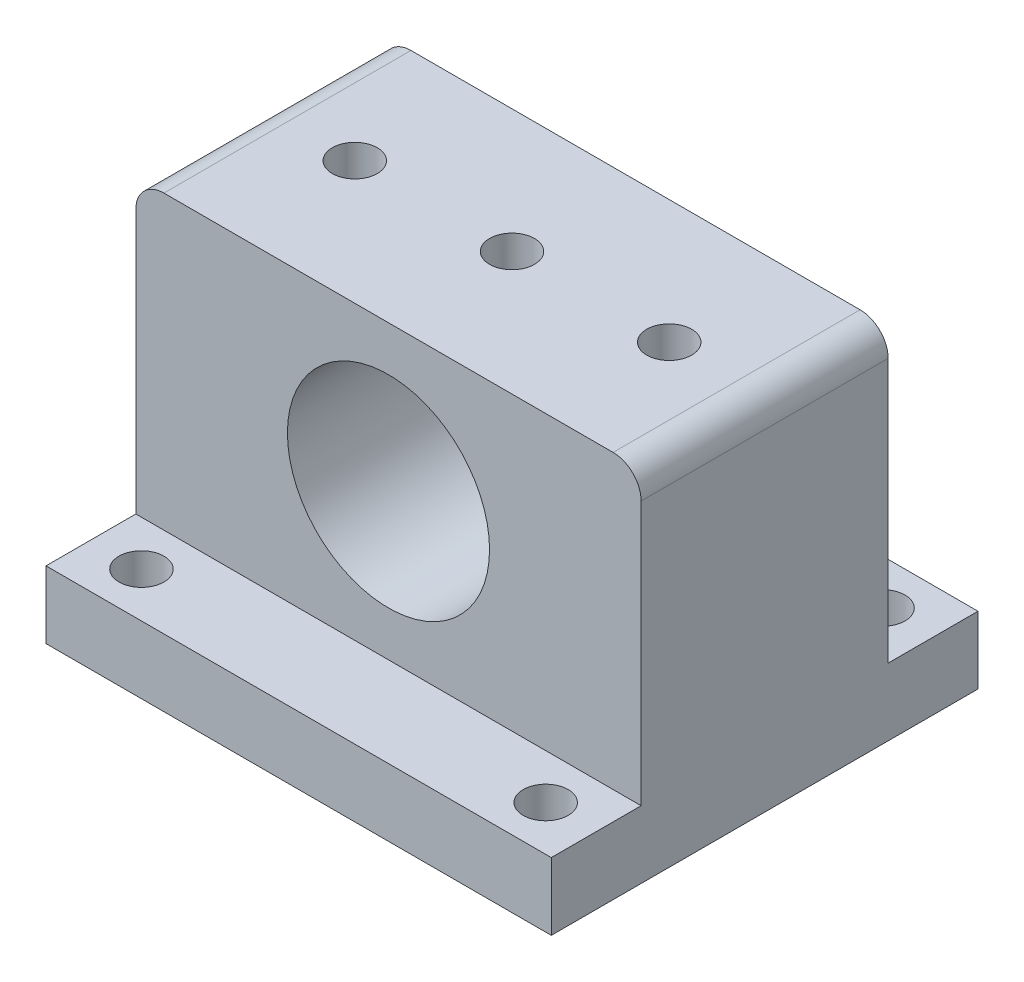
from build123d import *

# Parameters (mm, degrees)
SKETCH1_R           = 9
BOSS_EXTRUDE1_DEPTH = 11
SKETCH1_3_W         = 45
SKETCH1_3_H         = 6
BOSS_EXTRUDE2_DEPTH = 19
SKETCH2_R           = 2
CUT_EXTRUDE1_DEPTH  = 40.284220751
CUT_EXTRUDE2_REACH  = 45.489
SKETCH3_R           = 2
SKETCH3_3_R         = 2
CUT_EXTRUDE3_DEPTH  = 20


with BuildPart() as part:
    # Sketch1 → Boss-Extrude1 (new, symmetric)
    with BuildSketch(Plane.XY):
        with BuildLine():
            Line((20, 13), (-20, 13))
            ThreePointArc((-20, 13), (-21.767766953, 12.267766953), (-22.5, 10.5))
            Line((-22.5, 10.5), (-22.5, -13))
            Line((-22.5, -13), (22.5, -13))
            Line((22.5, -13), (22.5, 10.5))
            ThreePointArc((22.5, 10.5), (21.767766953, 12.267766953), (20, 13))
        make_face()
        Circle(SKETCH1_R, mode=Mode.SUBTRACT)
    extrude(amount=BOSS_EXTRUDE1_DEPTH, both=True)

    # Sketch1<3> → Boss-Extrude2 (add, symmetric)
    with BuildSketch(Plane.XY):
        with Locations((0, -16)):
            Rectangle(SKETCH1_3_W, SKETCH1_3_H)
    extrude(amount=BOSS_EXTRUDE2_DEPTH, both=True)

    # Sketch2 → Cut-Extrude1 (cut, through all)
    with BuildSketch(Plane(origin=(0, -13, 0), x_dir=(1, 0, 0), z_dir=(0, 1, 0))):
        with Locations((-18, -15)):
            Circle(SKETCH2_R)
        with Locations((18, -15)):
            Circle(SKETCH2_R)
        with Locations((18, 15)):
            Circle(SKETCH2_R)
        with Locations((-18, 15)):
            Circle(SKETCH2_R)
    extrude(amount=-CUT_EXTRUDE1_DEPTH, mode=Mode.SUBTRACT)

    # Sketch3 → Cut-Extrude2 (cut, up to next)
    with BuildSketch(Plane(origin=(0, 13, 0), x_dir=(1, 0, 0), z_dir=(0, 1, 0)), mode=Mode.PRIVATE) as cut_extrude2_sk1:
        Circle(SKETCH3_R)
    cut_extrude2_tool1 = extrude(cut_extrude2_sk1.sketch, amount=-CUT_EXTRUDE2_REACH, mode=Mode.PRIVATE) & part.part
    add(cut_extrude2_tool1.solids().sort_by_distance((0, 13, 0))[0], mode=Mode.SUBTRACT)

    # Sketch3<3> → Cut-Extrude3 (cut)
    with BuildSketch(Plane(origin=(0, 13, 0), x_dir=(1, 0, 0), z_dir=(0, 1, 0))):
        with Locations((-14, 0)):
            Circle(SKETCH3_3_R)
    cut_extrude3 = extrude(amount=-CUT_EXTRUDE3_DEPTH, mode=Mode.SUBTRACT)

    # Mirror1: Cut-Extrude3 across plane
    add(cut_extrude3.mirror(Plane(origin=(0, 0, 0), x_dir=(0, 0, 1), z_dir=(1, 0, 0))), mode=Mode.SUBTRACT)


solid = part.part
